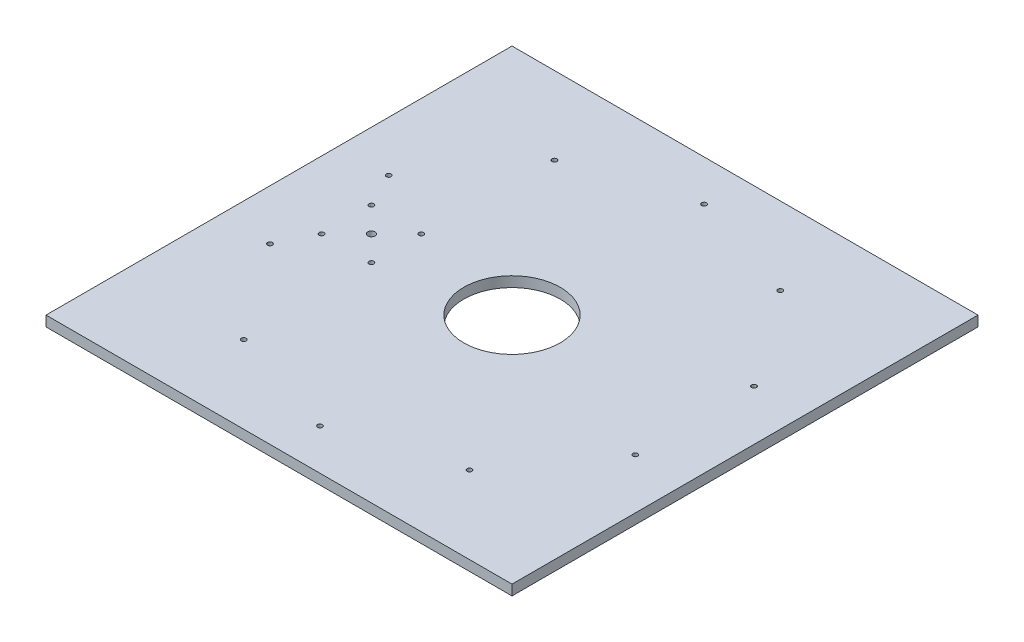
from build123d import *

# Parameters (mm, degrees)
SKETCH1_W           = 290
SKETCH1_H           = 290
BOSS_EXTRUDE1_DEPTH = 6.4
SKETCH2_R           = 30
SKETCH2_R_2         = 1.5
SKETCH2_R_3         = 2.25
CUT_EXTRUDE1_DEPTH  = 6.4


with BuildPart() as part:
    # Sketch1 → Boss-Extrude1 (new body)
    with BuildSketch(Plane(origin=(0, 0, 0), x_dir=(1, 0, 0), z_dir=(0, 1, 0))):
        Rectangle(SKETCH1_W, SKETCH1_H)
    extrude(amount=BOSS_EXTRUDE1_DEPTH)

    # Sketch2 → Cut-Extrude1 (cut)
    with BuildSketch(Plane(origin=(0, 6.4, 0), x_dir=(1, 0, 0), z_dir=(0, 1, 0))):
        with Locations(Location((0, 0, 0), (0, 0, 270))):
            Circle(SKETCH2_R)
        with Locations(Location((0, 119.525, 0), (0, 0, 270))):
            Circle(SKETCH2_R_2)
        with Locations(Location((70.25503228, 96.697756253, 0), (0, 0, 270))):
            Circle(SKETCH2_R_2)
        with Locations(Location((113.67503011, 36.935256253, 0), (0, 0, 270))):
            Circle(SKETCH2_R_2)
        with Locations(Location((113.67503011, -36.935256253, 0), (0, 0, 270))):
            Circle(SKETCH2_R_2)
        with Locations(Location((70.25503228, -96.697756253, 0), (0, 0, 270))):
            Circle(SKETCH2_R_2)
        with Locations(Location((0, -119.525, 0), (0, 0, 270))):
            Circle(SKETCH2_R_2)
        with Locations(Location((-70.25503228, -96.697756253, 0), (0, 0, 270))):
            Circle(SKETCH2_R_2)
        with Locations(Location((-113.67503011, -36.935256253, 0), (0, 0, 270))):
            Circle(SKETCH2_R_2)
        with Locations(Location((-113.67503011, 36.935256253, 0), (0, 0, 270))):
            Circle(SKETCH2_R_2)
        with Locations(Location((-70.25503228, 96.697756253, 0), (0, 0, 270))):
            Circle(SKETCH2_R_2)
        with Locations(Location((-87.5, 0, 0), (0, 0, 270))):
            Circle(SKETCH2_R_3)
        with Locations(Location((-103, 15.5, 0), (0, 0, 270))):
            Circle(SKETCH2_R_2)
        with Locations(Location((-72, 15.5, 0), (0, 0, 270))):
            Circle(SKETCH2_R_2)
        with Locations(Location((-72, -15.5, 0), (0, 0, 270))):
            Circle(SKETCH2_R_2)
        with Locations(Location((-103, -15.5, 0), (0, 0, 270))):
            Circle(SKETCH2_R_2)
    extrude(amount=-CUT_EXTRUDE1_DEPTH, mode=Mode.SUBTRACT)


solid = part.part
